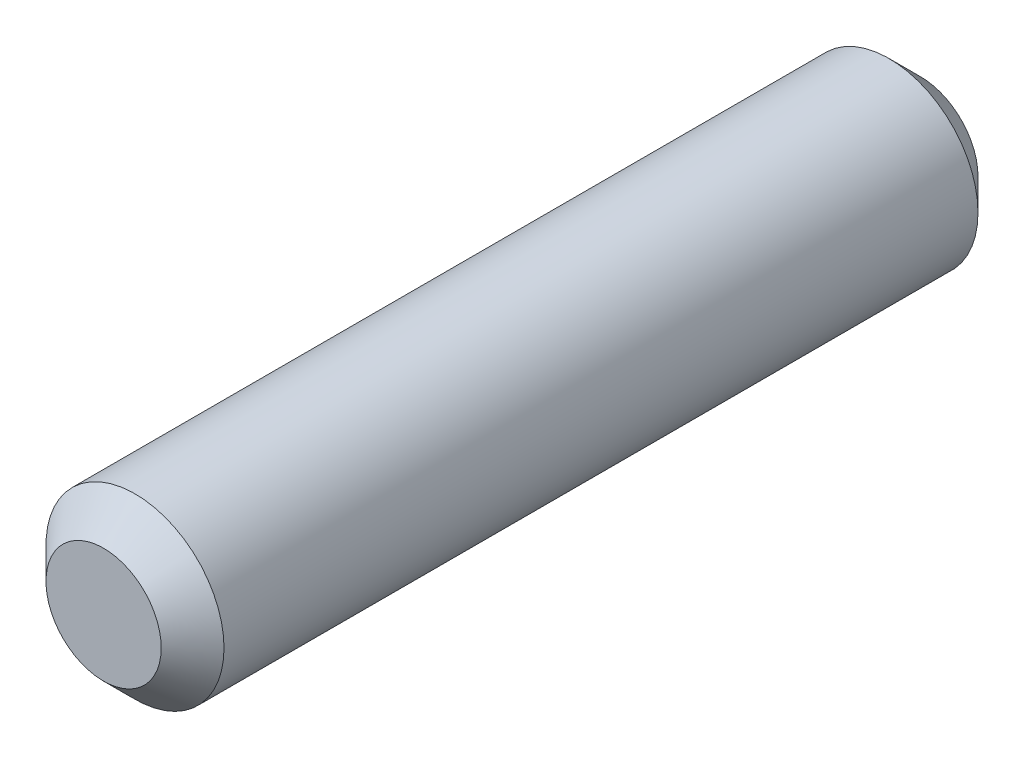
from build123d import *

# Parameters (mm, degrees)
SKETCH1_R           = 8.5
BOSS_EXTRUDE1_DEPTH = 39
CHAMFER1_SIZE       = 3


with BuildPart() as part:
    # Sketch1 → Boss-Extrude1 (new, symmetric)
    with BuildSketch(Plane.XY):
        Circle(SKETCH1_R)
    extrude(amount=BOSS_EXTRUDE1_DEPTH, both=True)

    # Chamfer1
    chamfer1_edges = [part.edges().sort_by_distance(p)[0] for p in [
        (-8.5, 0, -39),
        (-8.5, 0, 39),
    ]]
    chamfer(chamfer1_edges, length=CHAMFER1_SIZE)


solid = part.part
